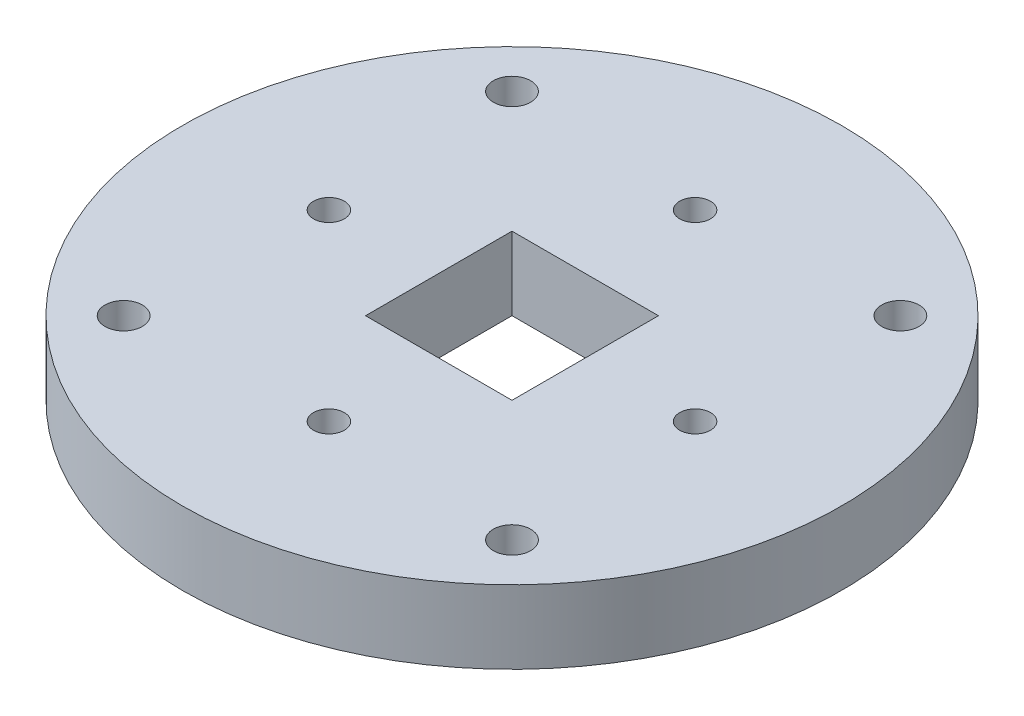
from build123d import *

# Parameters (mm, degrees)
SKETCH1_R           = 45
BOSS_EXTRUDE1_DEPTH = 10
SKETCH3_R           = 2.1
CUT_EXTRUDE2_DEPTH  = 65.420493634
CIRPATTERN1_COUNT   = 4
SKETCH4_W           = 20
SKETCH4_H           = 20
CUT_EXTRUDE3_DEPTH  = 10
SKETCH6_R           = 2.55
CUT_EXTRUDE4_DEPTH  = 65.420493634


with BuildPart() as part:
    # Sketch1 → Boss-Extrude1 (new body)
    with BuildSketch(Plane(origin=(0, 0, 0), x_dir=(1, 0, 0), z_dir=(0, 1, 0))):
        with Locations(Location((0, 0, 0), (0, 0, 270))):
            Circle(SKETCH1_R)
    extrude(amount=BOSS_EXTRUDE1_DEPTH)

    # Sketch3 → Cut-Extrude2 (cut, through all)
    with BuildSketch(Plane(origin=(0, 10, 0), x_dir=(1, 0, 0), z_dir=(0, 1, 0))):
        with Locations(Location((0, 25, 0), (0, 0, 270))):
            Circle(SKETCH3_R)
    cut_extrude2 = extrude(amount=-CUT_EXTRUDE2_DEPTH, mode=Mode.SUBTRACT)

    # CirPattern1: Cut-Extrude2 ×4 about axis
    cirpattern1_axis = Axis((0, 0, 0), (0, 1, 0))
    for i in range(1, CIRPATTERN1_COUNT):
        add(cut_extrude2.rotate(cirpattern1_axis, i * 360 / CIRPATTERN1_COUNT), mode=Mode.SUBTRACT)

    # Sketch4 → Cut-Extrude3 (cut)
    with BuildSketch(Plane(origin=(0, 10, 0), x_dir=(1, 0, 0), z_dir=(0, 1, 0))):
        Rectangle(SKETCH4_W, SKETCH4_H)
    extrude(amount=-CUT_EXTRUDE3_DEPTH, mode=Mode.SUBTRACT)

    # Sketch6 → Cut-Extrude4 (cut, through all)
    with BuildSketch(Plane(origin=(0, 10, 0), x_dir=(1, 0, 0), z_dir=(0, 1, 0))):
        with Locations(Location((-26.516504294, 26.516504294, 0), (0, 0, 270))):
            Circle(SKETCH6_R)
        with Locations(Location((26.516504294, 26.516504294, 0), (0, 0, 270))):
            Circle(SKETCH6_R)
        with Locations(Location((26.516504294, -26.516504294, 0), (0, 0, 270))):
            Circle(SKETCH6_R)
        with Locations(Location((-26.516504294, -26.516504294, 0), (0, 0, 270))):
            Circle(SKETCH6_R)
    extrude(amount=-CUT_EXTRUDE4_DEPTH, mode=Mode.SUBTRACT)


solid = part.part
